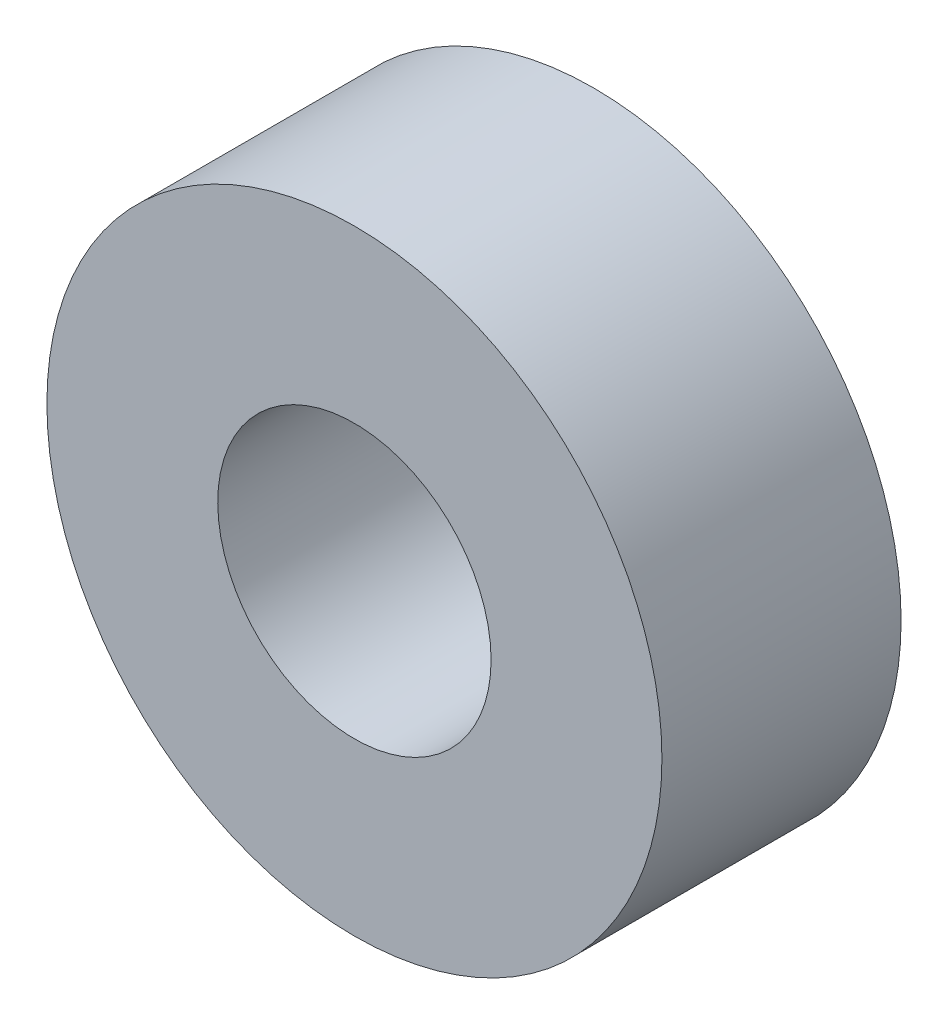
from build123d import *

# Parameters (mm, degrees)
SKETCH1_R           = 9
SKETCH1_R_2         = 4
BOSS_EXTRUDE1_DEPTH = 7


with BuildPart() as part:
    # Sketch1 → Boss-Extrude1 (new body)
    with BuildSketch(Plane.XY):
        with Locations(Location((0, 0, 0), (0, 0, 270))):
            Circle(SKETCH1_R)
        with Locations(Location((0, 0, 0), (0, 0, 93.325988531))):
            Circle(SKETCH1_R_2, mode=Mode.SUBTRACT)
    extrude(amount=BOSS_EXTRUDE1_DEPTH)


solid = part.part
